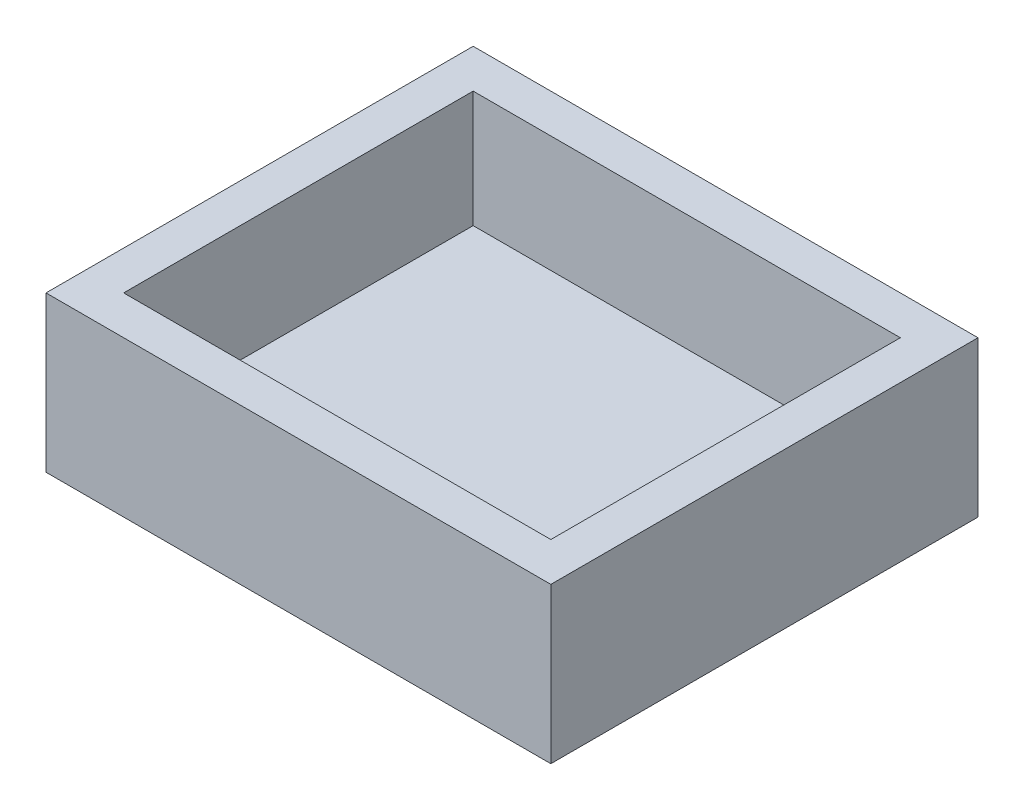
from build123d import *

# Parameters (mm, degrees)
SKETCH1_W           = 13000
SKETCH1_H           = 4000
BOSS_EXTRUDE2_DEPTH = 11000
SKETCH2_W           = 11000
SKETCH2_H           = 9000
CUT_EXTRUDE1_DEPTH  = 3000


with BuildPart() as part:
    # Sketch1 → Boss-Extrude2 (new body)
    with BuildSketch(Plane.XY):
        with Locations((6500, 2000)):
            Rectangle(SKETCH1_W, SKETCH1_H)
    extrude(amount=BOSS_EXTRUDE2_DEPTH)

    # Sketch2 → Cut-Extrude1 (cut)
    with BuildSketch(Plane(origin=(0, 4000, 0), x_dir=(1, 0, 0), z_dir=(0, 1, 0))):
        with Locations((6500, -5500)):
            Rectangle(SKETCH2_W, SKETCH2_H)
    extrude(amount=-CUT_EXTRUDE1_DEPTH, mode=Mode.SUBTRACT)


solid = part.part
